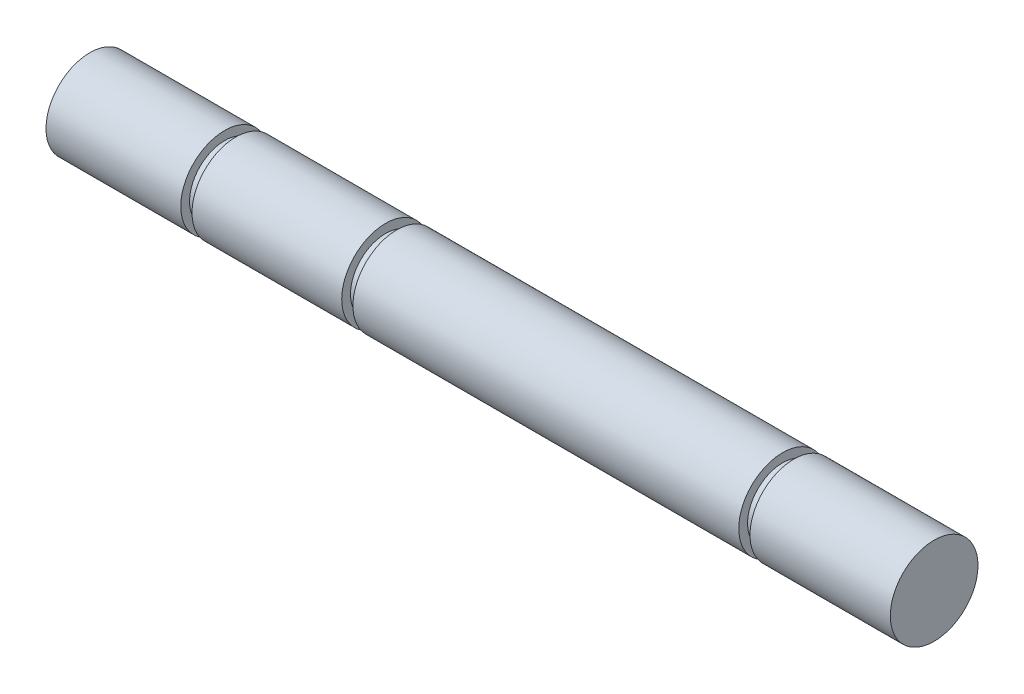
from build123d import *

# Parameters (mm, degrees)
SKETCH1_R           = 2.5
BOSS_EXTRUDE1_DEPTH = 100
CUT_EXTRUDE1_START  = -0.64
SKETCH2_R           = 2.5
SKETCH2_R_2         = 2
CUT_EXTRUDE1_DEPTH  = 0.64
CUT_EXTRUDE2_START  = -0.64
SKETCH3_R           = 2.5
SKETCH3_R_2         = 2
CUT_EXTRUDE2_DEPTH  = 0.64
CUT_EXTRUDE3_START  = 51.86
SKETCH4_R           = 2.5
CUT_EXTRUDE3_DEPTH  = 51.86
CUT_EXTRUDE4_START  = 0.64
SKETCH6_R           = 2.5
SKETCH6_R_2         = 2
CUT_EXTRUDE4_DEPTH  = 0.64


with BuildPart() as part:
    # Sketch1 → Boss-Extrude1 (new body)
    with BuildSketch(Plane(origin=(0, 0, 0), x_dir=(0, 0, -1), z_dir=(1, 0, 0))):
        Circle(SKETCH1_R)
    extrude(amount=BOSS_EXTRUDE1_DEPTH)

    # Sketch2 → Cut-Extrude1 (cut)
    with BuildSketch(Plane(origin=(92, 0, 0), x_dir=(0, 0, -1), z_dir=(1, 0, 0)).offset(CUT_EXTRUDE1_START)):
        Circle(SKETCH2_R)
        Circle(SKETCH2_R_2, mode=Mode.SUBTRACT)
    extrude(amount=CUT_EXTRUDE1_DEPTH, mode=Mode.SUBTRACT)

    # Sketch3 → Cut-Extrude2 (cut)
    with BuildSketch(Plane(origin=(69.36, 0, 0), x_dir=(0, 0, -1), z_dir=(1, 0, 0)).offset(CUT_EXTRUDE2_START)):
        Circle(SKETCH3_R)
        Circle(SKETCH3_R_2, mode=Mode.SUBTRACT)
    extrude(amount=CUT_EXTRUDE2_DEPTH, mode=Mode.SUBTRACT)

    # Sketch4 → Cut-Extrude3 (cut)
    with BuildSketch(Plane.ZY.offset(-51.86).offset(CUT_EXTRUDE3_START)):
        Circle(SKETCH4_R)
    extrude(amount=-CUT_EXTRUDE3_DEPTH, mode=Mode.SUBTRACT)

    # Sketch6 → Cut-Extrude4 (cut)
    with BuildSketch(Plane.ZY.offset(-60.185).offset(CUT_EXTRUDE4_START)):
        Circle(SKETCH6_R)
        with Locations(Location((0, 0, 0), (0, 0, 180))):
            Circle(SKETCH6_R_2, mode=Mode.SUBTRACT)
    extrude(amount=-CUT_EXTRUDE4_DEPTH, mode=Mode.SUBTRACT)


solid = part.part
